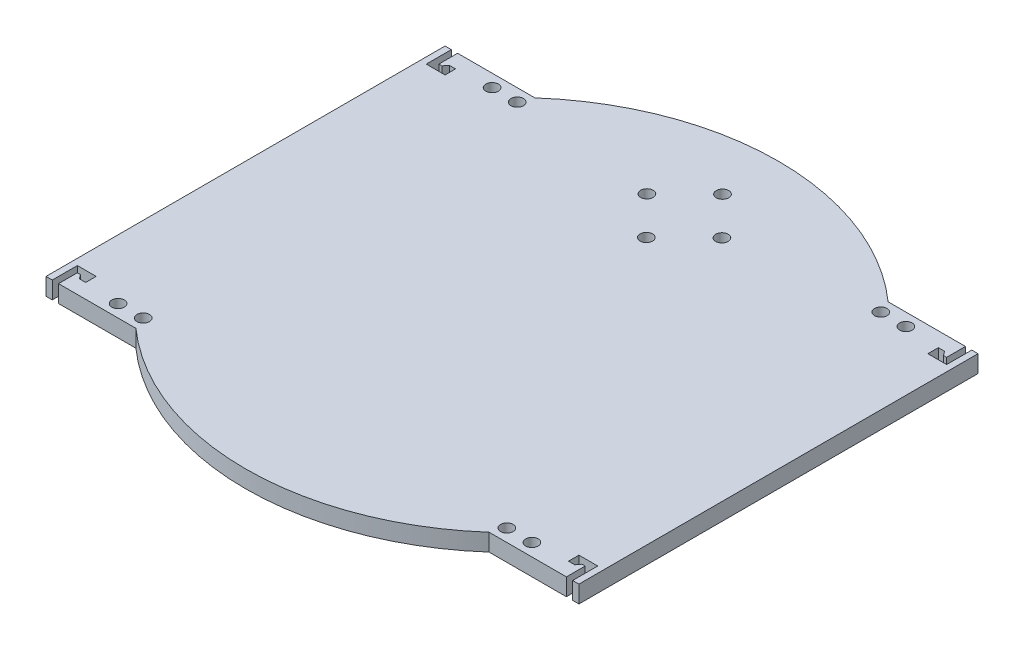
from build123d import *

# Parameters (mm, degrees)
SKETCH4_R           = 2
BOSS_EXTRUDE1_DEPTH = 5.5


with BuildPart() as part:
    # Sketch4 → Boss-Extrude1 (new body)
    with BuildSketch(Plane(origin=(0, 0, 0), x_dir=(1, 0, 0), z_dir=(0, 1, 0))):
        with BuildLine():
            Line((56.335401836, 63.65), (81, 63.65))
            Line((81, 63.65), (81, 57.659411765))
            Line((81, 57.659411765), (80, 57.659411765))
            Line((80, 57.659411765), (79, 58.992745098))
            Line((79, 58.992745098), (77, 58.992745098))
            Line((77, 58.992745098), (77, 55.65))
            Line((77, 55.65), (83, 55.65))
            Line((83, 55.65), (83, 63.65))
            Line((83, 63.65), (85, 63.65))
            Line((85, 63.65), (85, -63.65))
            Line((85, -63.65), (83, -63.65))
            Line((83, -63.65), (83, -55.65))
            Line((83, -55.65), (77, -55.65))
            Line((77, -55.65), (77, -58.992745098))
            Line((77, -58.992745098), (79, -58.992745098))
            Line((79, -58.992745098), (80, -57.659411765))
            Line((80, -57.659411765), (81, -57.659411765))
            Line((81, -57.659411765), (81, -63.65))
            Line((81, -63.65), (56.335401836, -63.65))
            ThreePointArc((56.335401836, -63.65), (0, -85), (-56.335401836, -63.65))
            Line((-56.335401836, -63.65), (-81, -63.65))
            Line((-81, -63.65), (-81, -57.659411765))
            Line((-81, -57.659411765), (-80, -57.659411765))
            Line((-80, -57.659411765), (-79, -58.992745098))
            Line((-79, -58.992745098), (-77, -58.992745098))
            Line((-77, -58.992745098), (-77, -55.65))
            Line((-77, -55.65), (-83, -55.65))
            Line((-83, -55.65), (-83, -63.65))
            Line((-83, -63.65), (-85, -63.65))
            Line((-85, -63.65), (-85, 63.65))
            Line((-85, 63.65), (-83, 63.65))
            Line((-83, 63.65), (-83, 55.65))
            Line((-83, 55.65), (-77, 55.65))
            Line((-77, 55.65), (-77, 58.992745098))
            Line((-77, 58.992745098), (-79, 58.992745098))
            Line((-79, 58.992745098), (-80, 57.659411765))
            Line((-80, 57.659411765), (-81, 57.659411765))
            Line((-81, 57.659411765), (-81, 63.65))
            Line((-81, 63.65), (-56.335401836, 63.65))
            ThreePointArc((-56.335401836, 63.65), (0, 85), (56.335401836, 63.65))
        make_face()
        with Locations(Location((-58, 59.65, 0), (0, 0, 270))):
            Circle(SKETCH4_R, mode=Mode.SUBTRACT)
        with Locations(Location((-66, 59.65, 0), (0, 0, 270))):
            Circle(SKETCH4_R, mode=Mode.SUBTRACT)
        with Locations(Location((66, 59.65, 0), (0, 0, 90))):
            Circle(SKETCH4_R, mode=Mode.SUBTRACT)
        with Locations(Location((58, 59.65, 0), (0, 0, 90))):
            Circle(SKETCH4_R, mode=Mode.SUBTRACT)
        with Locations(Location((66, -59.65, 0), (0, 0, 270))):
            Circle(SKETCH4_R, mode=Mode.SUBTRACT)
        with Locations(Location((58, -59.65, 0), (0, 0, 270))):
            Circle(SKETCH4_R, mode=Mode.SUBTRACT)
        with Locations(Location((-58, -59.65, 0), (0, 0, 90))):
            Circle(SKETCH4_R, mode=Mode.SUBTRACT)
        with Locations(Location((-66, -59.65, 0), (0, 0, 90))):
            Circle(SKETCH4_R, mode=Mode.SUBTRACT)
        with Locations(Location((12.148552835, 54.812479272, 0), (0, 0, 270))):
            Circle(SKETCH4_R, mode=Mode.SUBTRACT)
        with Locations(Location((0, 42.85, 0), (0, 0, 270))):
            Circle(SKETCH4_R, mode=Mode.SUBTRACT)
        with Locations(Location((-11.962479272, 54.998552835, 0), (0, 0, 270))):
            Circle(SKETCH4_R, mode=Mode.SUBTRACT)
        with Locations(Location((0.186073563, 66.961032106, 0), (0, 0, 270))):
            Circle(SKETCH4_R, mode=Mode.SUBTRACT)
    extrude(amount=BOSS_EXTRUDE1_DEPTH)


solid = part.part
